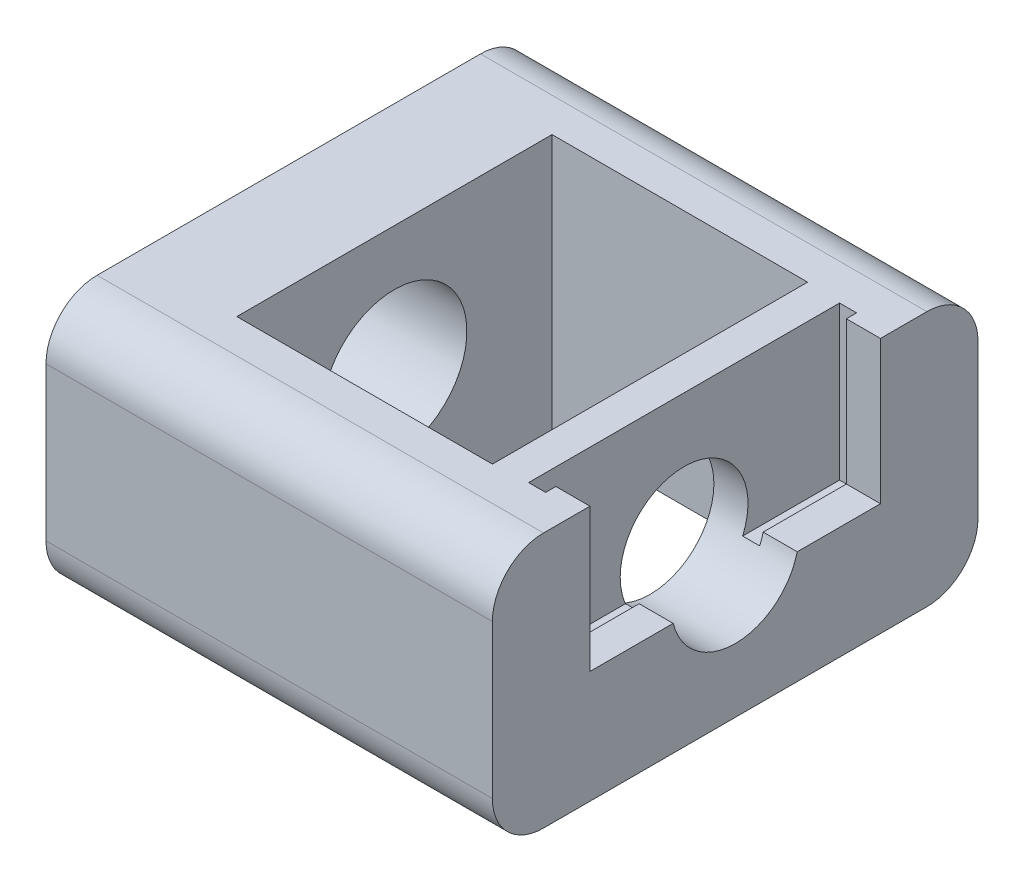
from build123d import *

# Parameters (mm, degrees)
SKETCH1_W           = 28.5
SKETCH1_H           = 15
SKETCH1_R           = 4.25
BOSS_EXTRUDE1_DEPTH = 6.2
SKETCH2_W           = 5
SKETCH2_H           = 15
BOSS_EXTRUDE2_DEPTH = 15
SKETCH3_W           = 5
SKETCH3_H           = 15
BOSS_EXTRUDE3_DEPTH = 5
CUT_EXTRUDE2_START  = 2
CUT_EXTRUDE2_DEPTH  = 1
CUT_EXTRUDE3_START  = 3
CUT_EXTRUDE3_DEPTH  = 2
FILLET1_R           = 3


with BuildPart() as part:
    # Sketch1 → Boss-Extrude1 (new body)
    with BuildSketch(Plane(origin=(0, 0, 0), x_dir=(0, 0, -1), z_dir=(1, 0, 0))):
        Rectangle(SKETCH1_W, SKETCH1_H)
        with Locations(Location((0, 0, 0), (0, 0, 180))):
            Circle(SKETCH1_R, mode=Mode.SUBTRACT)
    extrude(amount=BOSS_EXTRUDE1_DEPTH)

    # Sketch2 → Boss-Extrude2 (add)
    with BuildSketch(Plane(origin=(6.2, 0, 0), x_dir=(0, 0, -1), z_dir=(1, 0, 0))):
        with Locations((-11.75, 0)):
            Rectangle(SKETCH2_W, SKETCH2_H)
        with Locations((11.75, 0)):
            Rectangle(SKETCH2_W, SKETCH2_H)
    extrude(amount=BOSS_EXTRUDE2_DEPTH)

    # Sketch3 → Boss-Extrude3 (add)
    with BuildSketch(Plane(origin=(21.2, 0, 0), x_dir=(0, 0, -1), z_dir=(1, 0, 0))):
        with Locations((-11.75, 0)):
            Rectangle(SKETCH3_W, SKETCH3_H)
        with BuildLine():
            Line((8.525, -0.9), (8.525, 7.5))
            Line((8.525, 7.5), (-8.525, 7.5))
            Line((-8.525, 7.5), (-8.525, -0.9))
            Line((-8.525, -0.9), (-3.64039833, -0.9))
            ThreePointArc((-3.64039833, -0.9), (-0.453324532, 3.72249874), (3.75, 0))
            ThreePointArc((3.75, 0), (3.72249874, -0.453324532), (3.64039833, -0.9))
            Line((3.64039833, -0.9), (8.525, -0.9))
        make_face()
        with BuildLine():
            Line((-9.25, -7.5), (14.25, -7.5))
            Line((14.25, -7.5), (14.25, 7.5))
            Line((14.25, 7.5), (9.125, 7.5))
            Line((9.125, 7.5), (9.125, -1.5))
            Line((9.125, -1.5), (3.436931771, -1.5))
            ThreePointArc((3.436931771, -1.5), (0, -3.75), (-3.436931771, -1.5))
            Line((-3.436931771, -1.5), (-9.125, -1.5))
            Line((-9.125, -1.5), (-9.125, 7.5))
            Line((-9.125, 7.5), (-9.25, 7.5))
            Line((-9.25, 7.5), (-9.25, -7.5))
        make_face()
        with BuildLine():
            Line((-8.525, 7.5), (-9.125, 7.5))
            Line((-9.125, 7.5), (-9.125, -1.5))
            Line((-9.125, -1.5), (-3.436931771, -1.5))
            ThreePointArc((-3.436931771, -1.5), (-3.551358943, -1.204304638), (-3.64039833, -0.9))
            Line((-3.64039833, -0.9), (-8.525, -0.9))
            Line((-8.525, -0.9), (-8.525, 7.5))
        make_face()
        with BuildLine():
            Line((9.125, -1.5), (9.125, 7.5))
            Line((9.125, 7.5), (8.525, 7.5))
            Line((8.525, 7.5), (8.525, -0.9))
            Line((8.525, -0.9), (3.64039833, -0.9))
            ThreePointArc((3.64039833, -0.9), (3.551358943, -1.204304638), (3.436931771, -1.5))
            Line((3.436931771, -1.5), (9.125, -1.5))
        make_face()
    extrude(amount=BOSS_EXTRUDE3_DEPTH)

    # Sketch3<6> → Cut-Extrude2 (cut)
    with BuildSketch(Plane(origin=(21.2, 0, 0), x_dir=(0, 0, -1), z_dir=(1, 0, 0)).offset(CUT_EXTRUDE2_START)):
        with BuildLine():
            Line((8.525, -0.9), (8.525, 7.5))
            Line((8.525, 7.5), (-8.525, 7.5))
            Line((-8.525, 7.5), (-8.525, -0.9))
            Line((-8.525, -0.9), (-3.64039833, -0.9))
            ThreePointArc((-3.64039833, -0.9), (-0.453324532, 3.72249874), (3.75, 0))
            ThreePointArc((3.75, 0), (3.72249874, -0.453324532), (3.64039833, -0.9))
            Line((3.64039833, -0.9), (8.525, -0.9))
        make_face()
        with BuildLine():
            Line((-8.525, 7.5), (-9.125, 7.5))
            Line((-9.125, 7.5), (-9.125, -1.5))
            Line((-9.125, -1.5), (-3.436931771, -1.5))
            ThreePointArc((-3.436931771, -1.5), (-3.551358943, -1.204304638), (-3.64039833, -0.9))
            Line((-3.64039833, -0.9), (-8.525, -0.9))
            Line((-8.525, -0.9), (-8.525, 7.5))
        make_face()
        with BuildLine():
            Line((9.125, -1.5), (9.125, 7.5))
            Line((9.125, 7.5), (8.525, 7.5))
            Line((8.525, 7.5), (8.525, -0.9))
            Line((8.525, -0.9), (3.64039833, -0.9))
            ThreePointArc((3.64039833, -0.9), (3.551358943, -1.204304638), (3.436931771, -1.5))
            Line((3.436931771, -1.5), (9.125, -1.5))
        make_face()
    extrude(amount=CUT_EXTRUDE2_DEPTH, mode=Mode.SUBTRACT)

    # Sketch3<7> → Cut-Extrude3 (cut)
    with BuildSketch(Plane(origin=(21.2, 0, 0), x_dir=(0, 0, -1), z_dir=(1, 0, 0)).offset(CUT_EXTRUDE3_START)):
        with BuildLine():
            Line((8.525, -0.9), (8.525, 7.5))
            Line((8.525, 7.5), (-8.525, 7.5))
            Line((-8.525, 7.5), (-8.525, -0.9))
            Line((-8.525, -0.9), (-3.64039833, -0.9))
            ThreePointArc((-3.64039833, -0.9), (-0.453324532, 3.72249874), (3.75, 0))
            ThreePointArc((3.75, 0), (3.72249874, -0.453324532), (3.64039833, -0.9))
            Line((3.64039833, -0.9), (8.525, -0.9))
        make_face()
    extrude(amount=CUT_EXTRUDE3_DEPTH, mode=Mode.SUBTRACT)

    # Fillet1
    fillet1_edges = [part.edges().sort_by_distance(p)[0] for p in [
        (13.1, -7.5, -14.25),
        (13.1, -7.5, 14.25),
        (13.1, 7.5, 14.25),
        (13.1, 7.5, -14.25),
    ]]
    fillet(fillet1_edges, radius=FILLET1_R)


solid = part.part
